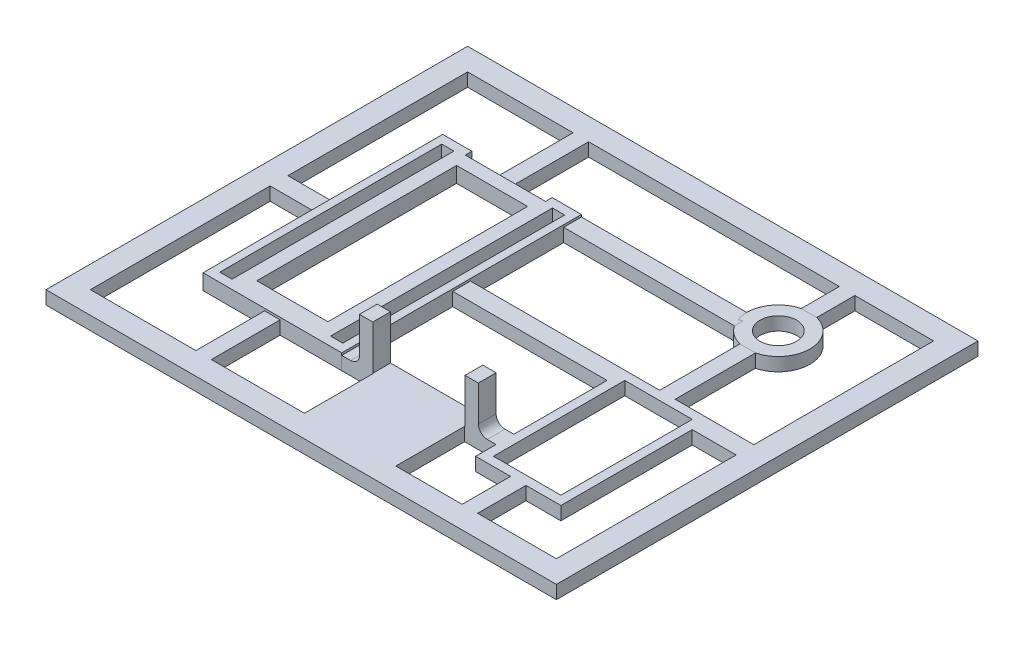
from build123d import *

# Parameters (mm, degrees)
SKETCH2_W           = 16
SKETCH2_H           = 45
SKETCH2_W_2         = 2.75
SKETCH2_H_2         = 50
BOSS_EXTRUDE1_DEPTH = 3.5
SKETCH3_W           = 19.2
SKETCH3_H           = 33.6
SKETCH3_W_2         = 15.2
SKETCH3_H_2         = 29.6
BOSS_EXTRUDE3_DEPTH = 3
SKETCH5_R           = 7.125
SKETCH5_R_2         = 4.125
BOSS_EXTRUDE5_DEPTH = 3
SKETCH4_W           = 115
SKETCH4_H           = 95
SKETCH4_W_2         = 110
SKETCH4_H_2         = 90
SKETCH4_W_3         = 105
SKETCH4_H_3         = 85
SKETCH4_W_4         = 3.5
SKETCH4_H_4         = 17
SKETCH4_W_5         = 9.8875
SKETCH4_H_5         = 4
SKETCH4_W_6         = 34.775
SKETCH4_H_6         = 15.5
SKETCH4_H_7         = 18.093255108
SKETCH4_H_8         = 8.593255108
SKETCH4_H_9         = 10.9
SKETCH4_W_7         = 38.478761792
SKETCH4_W_8         = 20.6
BOSS_EXTRUDE4_DEPTH = 3
SKETCH7_W           = 3
SKETCH7_H           = 4
BOSS_EXTRUDE6_DEPTH = 10
FILLET1_R           = 2
FILLET2_R           = 2


with BuildPart() as part:
    # Sketch2 → Boss-Extrude1 (new body)
    with BuildSketch(Plane(origin=(0, 0, 0), x_dir=(1, 0, 0), z_dir=(0, 1, 0))):
        Polygon((-15.625, -27), (15.625, -27), (15.625, 27), (9.05, 27), (9.05, 25.5), (-9.05, 25.5), (-9.05, 27), (-15.625, 27), align=None)
        Rectangle(SKETCH2_W, SKETCH2_H, mode=Mode.SUBTRACT)
        with Locations((12.475, 0.003539823)):
            Rectangle(SKETCH2_W_2, SKETCH2_H_2, mode=Mode.SUBTRACT)
        with Locations((-12.475, 0.003539823)):
            Rectangle(SKETCH2_W_2, SKETCH2_H_2, mode=Mode.SUBTRACT)
    extrude(amount=BOSS_EXTRUDE1_DEPTH)


with BuildPart() as body_2:
    # Sketch3 → Boss-Extrude3 (new body)
    with BuildSketch(Plane(origin=(0, 0, 0), x_dir=(1, 0, 0), z_dir=(0, 1, 0))):
        with Locations((60, -14.8)):
            Rectangle(SKETCH3_W, SKETCH3_H)
        with Locations((60, -14.8)):
            Rectangle(SKETCH3_W_2, SKETCH3_H_2, mode=Mode.SUBTRACT)
    extrude(amount=BOSS_EXTRUDE3_DEPTH)

    # Sketch4 → Boss-Extrude4 (add)
    # profile 1 of 13: a face of its own
    with BuildSketch(Plane(origin=(0, 0, 0), x_dir=(1, 0, 0), z_dir=(0, 1, 0))):
        with Locations((26.9875, 0)):
            Rectangle(SKETCH4_W, SKETCH4_H)
        with Locations((26.9875, 0)):
            Rectangle(SKETCH4_W_2, SKETCH4_H_2, mode=Mode.SUBTRACT)
    # profile 2 of 13: a face of its own
    with BuildSketch(Plane(origin=(0, 0, 0), x_dir=(1, 0, 0), z_dir=(0, 1, 0))):
        with Locations((26.9875, 0)):
            Rectangle(SKETCH4_W_2, SKETCH4_H_2)
        with Locations((26.9875, 0)):
            Rectangle(SKETCH4_W_3, SKETCH4_H_3, mode=Mode.SUBTRACT)
    # profile 3 of 13: a face of its own
    with BuildSketch(Plane(origin=(0, 0, 0), x_dir=(1, 0, 0), z_dir=(0, 1, 0))):
        with Locations((0, 34)):
            Rectangle(SKETCH4_W_4, SKETCH4_H_4)
    # profile 4 of 13: a face of its own
    with BuildSketch(Plane(origin=(0, 0, 0), x_dir=(1, 0, 0), z_dir=(0, 1, 0))):
        with Locations((-20.56875, 0)):
            Rectangle(SKETCH4_W_5, SKETCH4_H_5)
    # profile 5 of 13: a face of its own
    with BuildSketch(Plane(origin=(0, 0, 0), x_dir=(1, 0, 0), z_dir=(0, 1, 0))):
        with Locations((33.0125, 0)):
            Rectangle(SKETCH4_W_6, SKETCH4_H_5)
    # profile 6 of 13: a face of its own
    with BuildSketch(Plane(origin=(0, 0, 0), x_dir=(1, 0, 0), z_dir=(0, 1, 0))):
        with Locations((74.54375, 0)):
            Rectangle(SKETCH4_W_5, SKETCH4_H_5)
    # profile 7 of 13: a face of its own
    with BuildSketch(Plane(origin=(0, 0, 0), x_dir=(1, 0, 0), z_dir=(0, 1, 0))):
        with Locations((0, -34.75)):
            Rectangle(SKETCH4_W_4, SKETCH4_H_6)
    # profile 8 of 13: a face of its own
    with BuildSketch(Plane(origin=(0, 0, 0), x_dir=(1, 0, 0), z_dir=(0, 1, 0))):
        with Locations((60, 11.046627554)):
            Rectangle(SKETCH4_W_4, SKETCH4_H_7)
    # profile 9 of 13: a face of its own
    with BuildSketch(Plane(origin=(0, 0, 0), x_dir=(1, 0, 0), z_dir=(0, 1, 0))):
        with Locations((60, 38.203372446)):
            Rectangle(SKETCH4_W_4, SKETCH4_H_8)
    # profile 10 of 13: a face of its own
    with BuildSketch(Plane(origin=(0, 0, 0), x_dir=(1, 0, 0), z_dir=(0, 1, 0))):
        with Locations((60, -37.05)):
            Rectangle(SKETCH4_W_4, SKETCH4_H_9)
    # profile 11 of 13: a face of its own
    with BuildSketch(Plane(origin=(0, 0, 0), x_dir=(1, 0, 0), z_dir=(0, 1, 0))):
        with Locations((34.864380896, 25)):
            Rectangle(SKETCH4_W_7, SKETCH4_H_5)
    # profile 12 of 13: a face of its own
    with BuildSketch(Plane(origin=(0, 0, 0), x_dir=(1, 0, 0), z_dir=(0, 1, 0))):
        with Locations((33.0125, -25)):
            Rectangle(SKETCH4_W_6, SKETCH4_H_5)
    # profile 13 of 13: a face of its own
    with BuildSketch(Plane(origin=(0, 0, 0), x_dir=(1, 0, 0), z_dir=(0, 1, 0))):
        with Locations((33.0125, -34.75)):
            Rectangle(SKETCH4_W_8, SKETCH4_H_6)
    extrude(amount=BOSS_EXTRUDE4_DEPTH)


with BuildPart() as body_3:
    # Sketch5 → Boss-Extrude5 (new body)
    with BuildSketch(Plane(origin=(0, 0, 0), x_dir=(1, 0, 0), z_dir=(0, 1, 0))):
        with Locations(Location((60, 27, 0), (0, 0, 270))):
            Circle(SKETCH5_R)
        with Locations(Location((60, 27, 0), (0, 0, 270))):
            Circle(SKETCH5_R_2, mode=Mode.SUBTRACT)
    extrude(amount=BOSS_EXTRUDE5_DEPTH)


with BuildPart() as boss_extrude4_piece_1:
    # of the separate pieces the step leaves, piece 1, a body of its own (boss_extrude4_pieces)
    add(body_2.part.solids().sort_by_distance((58.25, 0, -2))[0])

    # Sketch7 → Boss-Extrude6 (add)
    with BuildSketch(Plane(origin=(0, 3, 0), x_dir=(1, 0, 0), z_dir=(0, 1, 0))):
        with Locations((21.1125, -25)):
            Rectangle(SKETCH7_W, SKETCH7_H)
        with Locations((44.9125, -25)):
            Rectangle(SKETCH7_W, SKETCH7_H)
    extrude(amount=BOSS_EXTRUDE6_DEPTH)

    # Fillet1
    fillet1_edges = [boss_extrude4_piece_1.edges().sort_by_distance(p)[0] for p in [
        (19.6125, 3, 25),
    ]]
    fillet(fillet1_edges, radius=FILLET1_R)

    # Fillet2
    fillet2_edges = [boss_extrude4_piece_1.edges().sort_by_distance(p)[0] for p in [
        (46.4125, 3, 25),
    ]]
    fillet(fillet2_edges, radius=FILLET2_R)


with BuildPart() as boss_extrude4_piece_2:
    # of the separate pieces the step leaves, piece 2, a body of its own (boss_extrude4_pieces)
    add(body_2.part.solids().sort_by_distance((54.103761792, 0, -27))[0])


solid = Compound([part.part, body_3.part, boss_extrude4_piece_1.part, boss_extrude4_piece_2.part])
